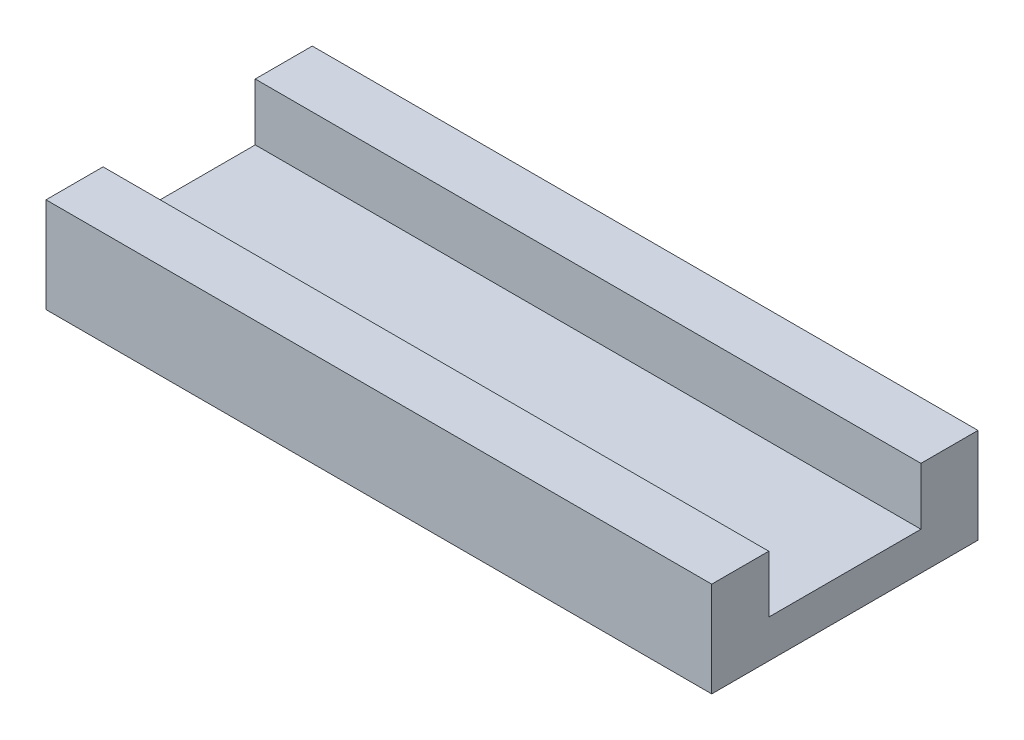
from build123d import *

# Parameters (mm, degrees)
BOSS_EXTRUDE1_DEPTH = 35


with BuildPart() as part:
    # Sketch1 → Boss-Extrude1 (new body)
    with BuildSketch(Plane(origin=(0, 0, 0), x_dir=(0, 0, -1), z_dir=(1, 0, 0))):
        Polygon((-7, 1), (-7, 4), (-4, 4), (-4, 1), (4, 1), (4, 4), (7, 4), (7, 1), (7, -1), (-7, -1), align=None)
    extrude(amount=-BOSS_EXTRUDE1_DEPTH)


solid = part.part
